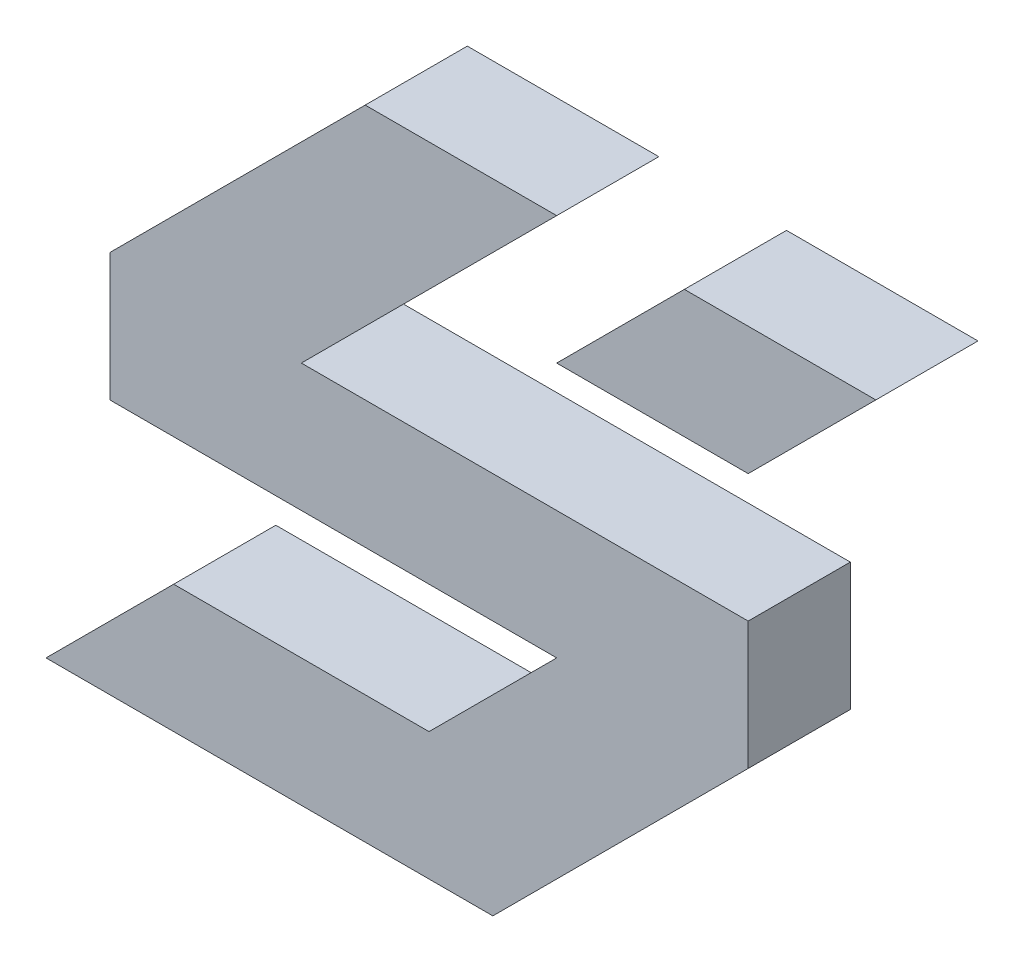
from build123d import *

# Parameters (mm, degrees)
BOSS_EXTRUDE1_DEPTH = 10


with BuildPart() as part:
    # Sketch1 → Boss-Extrude1 (new body)
    with BuildSketch(Plane.XY):
        Polygon((100, 62.5), (87.5, 50), (100, 50), (112.5, 62.5), align=None)
        Polygon((93.75, 62.5), (81.25, 50), (87.5, 50), (100, 62.5), align=None)
        Polygon((62.5, 62.5), (50, 50), (68.75, 50), (81.25, 62.5), align=None)
        Polygon((50, 50), (37.5, 37.5), (56.25, 37.5), (68.75, 50), align=None)
        Polygon((37.5, 25), (43.75, 25), (56.25, 37.5), (37.5, 37.5), align=None)
        Polygon((56.25, 37.5), (43.75, 25), (62.5, 25), (75, 37.5), align=None)
        Polygon((75, 37.5), (62.5, 25), (81.25, 25), (93.75, 37.5), align=None)
        Polygon((93.75, 37.5), (81.25, 25), (100, 25), (100, 37.5), align=None)
        Polygon((81.25, 25), (68.75, 12.5), (87.5, 12.5), (100, 25), align=None)
        Polygon((68.75, 12.5), (56.25, 0), (75, 0), (87.5, 12.5), align=None)
        Polygon((50, 12.5), (37.5, 0), (56.25, 0), (68.75, 12.5), align=None)
        Polygon((43.75, 12.5), (31.25, 0), (37.5, 0), (50, 12.5), align=None)
    extrude(amount=BOSS_EXTRUDE1_DEPTH)


solid = part.part
